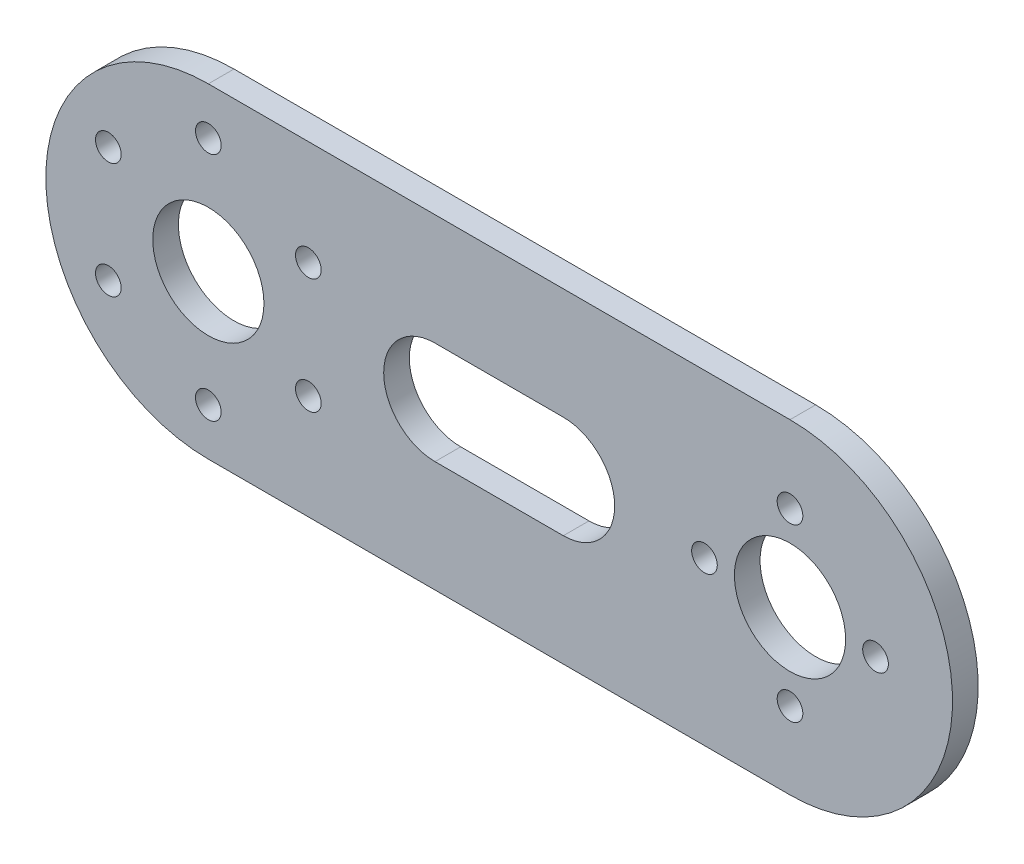
from build123d import *

# Parameters (mm, degrees)
SKETCH_1_R          = 19
SKETCH_1_R_2        = 1.5
SKETCH_1_R_3        = 6.5
EXTRUDE_1_DEPTH     = 3
SKETCH_2_R          = 6.5
CUT_EXTRUDE_1_DEPTH = 90.101066211


with BuildPart() as part:
    # 草图1 → 凸台-拉伸1 (new body)
    # profile 1 of 3: a face of its own
    with BuildSketch(Plane.XY):
        Circle(SKETCH_1_R)
        with Locations((0, 13.5)):
            Circle(SKETCH_1_R_2, mode=Mode.SUBTRACT)
        with Locations((11.691342951, 6.75)):
            Circle(SKETCH_1_R_2, mode=Mode.SUBTRACT)
        with Locations((11.691342951, -6.75)):
            Circle(SKETCH_1_R_2, mode=Mode.SUBTRACT)
        with Locations((0, -13.5)):
            Circle(SKETCH_1_R_2, mode=Mode.SUBTRACT)
        with Locations((-11.691342951, -6.75)):
            Circle(SKETCH_1_R_2, mode=Mode.SUBTRACT)
        with Locations((-11.691342951, 6.75)):
            Circle(SKETCH_1_R_2, mode=Mode.SUBTRACT)
        Circle(SKETCH_1_R_3, mode=Mode.SUBTRACT)
    # profile 2 of 3: a face of its own
    with BuildSketch(Plane.XY):
        with BuildLine():
            Line((68, 19), (0, 19))
            ThreePointArc((0, 19), (13.435028843, 13.435028843), (19, 0))
            ThreePointArc((19, 0), (13.435028843, -13.435028843), (0, -19))
            Line((0, -19), (68, -19))
            ThreePointArc((68, -19), (49, 0), (68, 19))
        make_face()
    # profile 3 of 3: a face of its own
    with BuildSketch(Plane.XY):
        with Locations((68, 0)):
            Circle(SKETCH_1_R)
        with Locations((68, 0)):
            Circle(SKETCH_1_R_3, mode=Mode.SUBTRACT)
        with Locations((68, 10)):
            Circle(SKETCH_1_R_2, mode=Mode.SUBTRACT)
        with Locations((78, 0)):
            Circle(SKETCH_1_R_2, mode=Mode.SUBTRACT)
        with Locations((68, -10)):
            Circle(SKETCH_1_R_2, mode=Mode.SUBTRACT)
        with Locations((58, 0)):
            Circle(SKETCH_1_R_2, mode=Mode.SUBTRACT)
    extrude(amount=EXTRUDE_1_DEPTH)

    # 草图2 → 切除-拉伸1 (cut, through all)
    with BuildSketch(Plane.XY.offset(3)):
        with Locations((68, 0)):
            Circle(SKETCH_2_R)
        with BuildLine():
            Line((26.5, 6), (41.5, 6))
            ThreePointArc((41.5, 6), (47.5, 0), (41.5, -6))
            Line((41.5, -6), (26.5, -6))
            ThreePointArc((26.5, -6), (20.5, 0), (26.5, 6))
        make_face()
    extrude(amount=-CUT_EXTRUDE_1_DEPTH, mode=Mode.SUBTRACT)


solid = part.part
